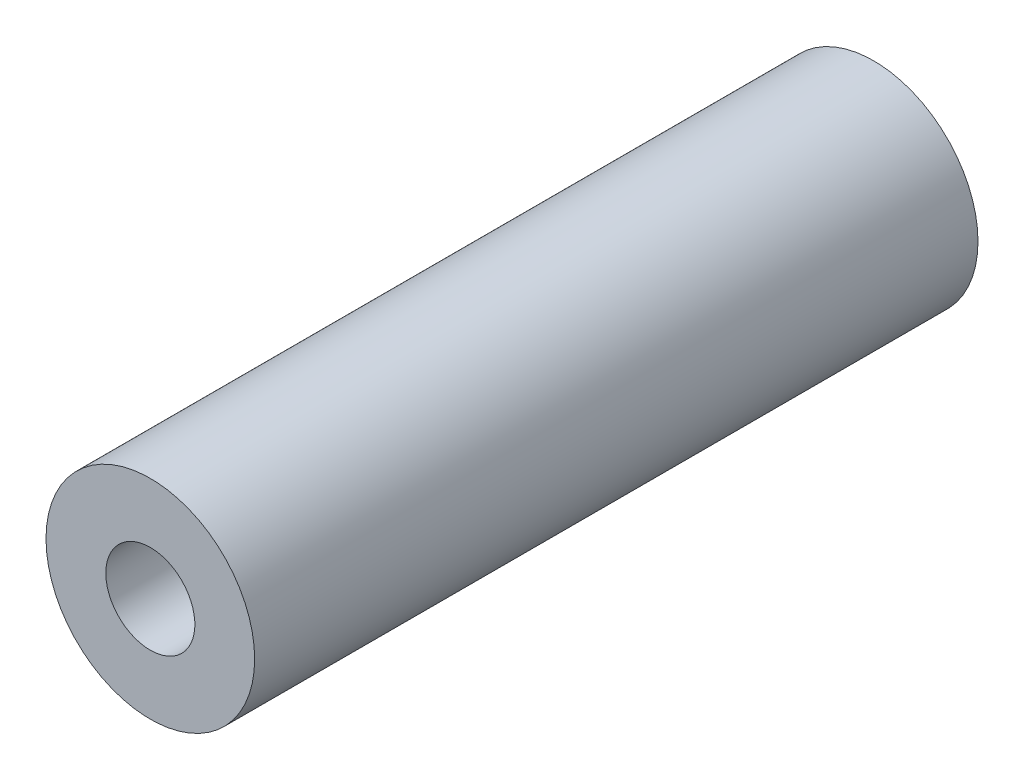
from build123d import *

# Parameters (mm, degrees)
SKETCH1_R           = 3.75
SKETCH1_R_2         = 1.6
BOSS_EXTRUDE1_DEPTH = 26


with BuildPart() as part:
    # Sketch1 → Boss-Extrude1 (new body)
    with BuildSketch(Plane.XY):
        with Locations(Location((0, 0, 0), (0, 0, 180))):
            Circle(SKETCH1_R)
        with Locations(Location((0, 0, 0), (0, 0, 180))):
            Circle(SKETCH1_R_2, mode=Mode.SUBTRACT)
    extrude(amount=BOSS_EXTRUDE1_DEPTH)


solid = part.part
